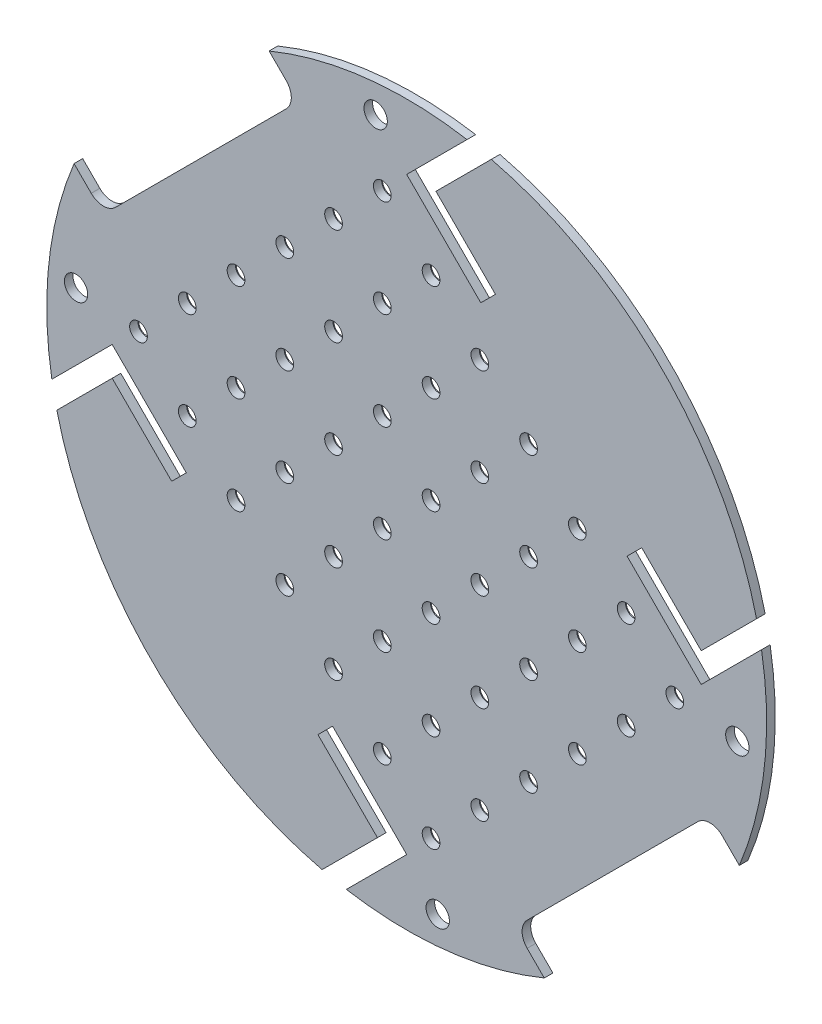
from build123d import *

# Parameters (mm, degrees)
SKETCH1_R             = 66.294
EXTRUDE1_DEPTH        = 1.5875
EXTRUDE2_DEPTH        = 94.767313219
CIRPATTERN1_COUNT     = 2
CIRPATTERN1_ANGLE     = 180
EXTRUDE3_DEPTH        = 94.767313219
CIRPATTERN4_COUNT     = 2
CIRPATTERN4_ANGLE     = 180
F_6_CLEARANCE_HOLE1_D = 4.3053
CIRPATTERN3_COUNT     = 2
CIRPATTERN3_ANGLE     = 180
LPATTERN1_COUNT       = 3
LPATTERN1_PITCH       = 12.7
LPATTERN1_COL_COUNT   = 4
LPATTERN1_COL_PITCH   = 12.7
LPATTERN2_COUNT       = 4
LPATTERN2_PITCH       = 12.7
LPATTERN2_COL_COUNT   = 4
LPATTERN2_COL_PITCH   = 12.7
FILLET1_R             = 3.175


with BuildPart() as part:
    # Sketch1 → Extrude1 (new body)
    with BuildSketch(Plane.XY):
        Circle(SKETCH1_R)
    extrude(amount=EXTRUDE1_DEPTH)

    # Sketch3 → Extrude2 (cut, through all)
    with BuildSketch(Plane.XY.offset(1.5875)):
        Polygon((12.180253029, 66.421), (66.421, 66.421), (66.421, 12.180253029), (54.240746971, 0), (40.590757667, 13.649989304), (43.284834504, 16.34406614), (54.240746971, 5.388153673), (65.507128801, 16.654535502), (65.507128801, 65.507128801), (16.654535502, 65.507128801), (5.388153673, 54.240746971), (16.34406614, 43.284834504), (13.649989304, 40.590757667), (0, 54.240746971), align=None)
    extrude2 = extrude(amount=-EXTRUDE2_DEPTH, mode=Mode.SUBTRACT)

    # CirPattern1: Extrude2 ×2 about axis
    cirpattern1_axis = Axis((0, 0, 0), (0, 0, 1))
    for i in range(1, CIRPATTERN1_COUNT):
        add(extrude2.rotate(cirpattern1_axis, i * CIRPATTERN1_ANGLE / (CIRPATTERN1_COUNT - 1)), mode=Mode.SUBTRACT)

    # Sketch11 → Extrude3 (cut, through all)
    with BuildSketch(Plane(origin=(0, 0, 0), x_dir=(-1, 0, 0), z_dir=(0, 0, -1))):
        Polygon((-55.860393937, -19.939369453), (-69.011215099, -33.090190614), (-33.090190614, -69.011215099), (-19.939369453, -55.860393937), align=None)
    extrude3 = extrude(amount=-EXTRUDE3_DEPTH, mode=Mode.SUBTRACT)

    # CirPattern4: Extrude3 ×2 about axis
    cirpattern4_axis = Axis((0, 0, 0), (0, 0, 1))
    for i in range(1, CIRPATTERN4_COUNT):
        add(extrude3.rotate(cirpattern4_axis, i * CIRPATTERN4_ANGLE / (CIRPATTERN4_COUNT - 1)), mode=Mode.SUBTRACT)

    # #6 Clearance Hole1 (through all)
    with Locations(Plane(origin=(-5.715, 60.8965, 1.5875), x_dir=(1, 0, 0), z_dir=(0, 0, 1))):
        with Locations((0, 0), (66.6115, -66.6115)):
            f_6_clearance_hole1 = Hole(F_6_CLEARANCE_HOLE1_D / 2)

    # CirPattern3: #6 Clearance Hole1 ×2 about axis
    cirpattern3_axis = Axis((0, 0, 0), (0, 0, 1))
    for i in range(1, CIRPATTERN3_COUNT):
        add(f_6_clearance_hole1.rotate(cirpattern3_axis, i * CIRPATTERN3_ANGLE / (CIRPATTERN3_COUNT - 1)), mode=Mode.SUBTRACT)

    # Sketch21 → #4 Clearance Hole1 (revolve, cut)
    with BuildSketch(Plane(origin=(-4.490128061, -4.490128061, 1.5875), x_dir=(0, -1, 0), z_dir=(1, 0, 0))):
        Polygon((0, 0), (0, 2.504574487), (1.63195, 1.524), (1.63195, 0), align=None)
    f_4_clearance_hole1 = revolve(axis=Axis((-4.490128061, -4.490128061, 7.9375), (0, 0, -1)), mode=Mode.SUBTRACT)

    # LPattern1: #4 Clearance Hole1 ×3
    with Locations(*[Vector(-0.7071067811865526, -0.7071067811865426, 0) * (i * LPATTERN1_PITCH) for i in range(1, LPATTERN1_COUNT)]):
        add(f_4_clearance_hole1, mode=Mode.SUBTRACT)

    # LPattern1 col: #4 Clearance Hole1 ×4
    with Locations(*[Vector(0.7071067811865476, 0.7071067811865475, 0) * (i * LPATTERN1_COL_PITCH) for i in range(1, LPATTERN1_COL_COUNT)]):
        add(f_4_clearance_hole1, mode=Mode.SUBTRACT)

    # LPattern2: #4 Clearance Hole1 ×4
    with Locations(*[Vector(0.7071067811865476, -0.7071067811865475, 0) * (i * LPATTERN2_PITCH) for i in range(1, LPATTERN2_COUNT)]):
        add(f_4_clearance_hole1, mode=Mode.SUBTRACT)

    # LPattern2 copy 1 sketch → LPattern2 copy 1 (revolve, cut)
    with BuildSketch(Plane(origin=(-4.490128061, -22.450640303, 1.5875), x_dir=(0, -1, 0), z_dir=(1, 0, 0))):
        Polygon((0, 0), (0, 2.504574487), (1.63195, 1.524), (1.63195, 0), align=None)
    revolve(axis=Axis((-4.490128061, -22.450640303, 7.9375), (0, 0, -1)), mode=Mode.SUBTRACT)

    # LPattern2 copy 2 sketch → LPattern2 copy 2 (revolve, cut)
    with BuildSketch(Plane(origin=(4.490128061, -31.430896424, 1.5875), x_dir=(0, -1, 0), z_dir=(1, 0, 0))):
        Polygon((0, 0), (0, 2.504574487), (1.63195, 1.524), (1.63195, 0), align=None)
    revolve(axis=Axis((4.490128061, -31.430896424, 7.9375), (0, 0, -1)), mode=Mode.SUBTRACT)

    # LPattern2 copy 3 sketch → LPattern2 copy 3 (revolve, cut)
    with BuildSketch(Plane(origin=(13.470384182, -40.411152545, 1.5875), x_dir=(0, -1, 0), z_dir=(1, 0, 0))):
        Polygon((0, 0), (0, 2.504574487), (1.63195, 1.524), (1.63195, 0), align=None)
    revolve(axis=Axis((13.470384182, -40.411152545, 7.9375), (0, 0, -1)), mode=Mode.SUBTRACT)

    # LPattern2 copy 4 sketch → LPattern2 copy 4 (revolve, cut)
    with BuildSketch(Plane(origin=(-13.470384182, -31.430896424, 1.5875), x_dir=(0, -1, 0), z_dir=(1, 0, 0))):
        Polygon((0, 0), (0, 2.504574487), (1.63195, 1.524), (1.63195, 0), align=None)
    revolve(axis=Axis((-13.470384182, -31.430896424, 7.9375), (0, 0, -1)), mode=Mode.SUBTRACT)

    # LPattern2 copy 5 sketch → LPattern2 copy 5 (revolve, cut)
    with BuildSketch(Plane(origin=(-4.490128061, -40.411152545, 1.5875), x_dir=(0, -1, 0), z_dir=(1, 0, 0))):
        Polygon((0, 0), (0, 2.504574487), (1.63195, 1.524), (1.63195, 0), align=None)
    revolve(axis=Axis((-4.490128061, -40.411152545, 7.9375), (0, 0, -1)), mode=Mode.SUBTRACT)

    # LPattern2 copy 6 sketch → LPattern2 copy 6 (revolve, cut)
    with BuildSketch(Plane(origin=(4.490128061, -49.391408666, 1.5875), x_dir=(0, -1, 0), z_dir=(1, 0, 0))):
        Polygon((0, 0), (0, 2.504574487), (1.63195, 1.524), (1.63195, 0), align=None)
    revolve(axis=Axis((4.490128061, -49.391408666, 7.9375), (0, 0, -1)), mode=Mode.SUBTRACT)

    # LPattern2 copy 7 sketch → LPattern2 copy 7 (revolve, cut)
    with BuildSketch(Plane(origin=(13.470384182, -4.490128061, 1.5875), x_dir=(0, -1, 0), z_dir=(1, 0, 0))):
        Polygon((0, 0), (0, 2.504574487), (1.63195, 1.524), (1.63195, 0), align=None)
    revolve(axis=Axis((13.470384182, -4.490128061, 7.9375), (0, 0, -1)), mode=Mode.SUBTRACT)

    # LPattern2 copy 8 sketch → LPattern2 copy 8 (revolve, cut)
    with BuildSketch(Plane(origin=(22.450640303, -13.470384182, 1.5875), x_dir=(0, -1, 0), z_dir=(1, 0, 0))):
        Polygon((0, 0), (0, 2.504574487), (1.63195, 1.524), (1.63195, 0), align=None)
    revolve(axis=Axis((22.450640303, -13.470384182, 7.9375), (0, 0, -1)), mode=Mode.SUBTRACT)

    # LPattern2 copy 9 sketch → LPattern2 copy 9 (revolve, cut)
    with BuildSketch(Plane(origin=(31.430896424, -22.450640303, 1.5875), x_dir=(0, -1, 0), z_dir=(1, 0, 0))):
        Polygon((0, 0), (0, 2.504574487), (1.63195, 1.524), (1.63195, 0), align=None)
    revolve(axis=Axis((31.430896424, -22.450640303, 7.9375), (0, 0, -1)), mode=Mode.SUBTRACT)

    # LPattern2 copy 10 sketch → LPattern2 copy 10 (revolve, cut)
    with BuildSketch(Plane(origin=(22.450640303, 4.490128061, 1.5875), x_dir=(0, -1, 0), z_dir=(1, 0, 0))):
        Polygon((0, 0), (0, 2.504574487), (1.63195, 1.524), (1.63195, 0), align=None)
    revolve(axis=Axis((22.450640303, 4.490128061, 7.9375), (0, 0, -1)), mode=Mode.SUBTRACT)

    # LPattern2 copy 11 sketch → LPattern2 copy 11 (revolve, cut)
    with BuildSketch(Plane(origin=(31.430896424, -4.490128061, 1.5875), x_dir=(0, -1, 0), z_dir=(1, 0, 0))):
        Polygon((0, 0), (0, 2.504574487), (1.63195, 1.524), (1.63195, 0), align=None)
    revolve(axis=Axis((31.430896424, -4.490128061, 7.9375), (0, 0, -1)), mode=Mode.SUBTRACT)

    # LPattern2 copy 12 sketch → LPattern2 copy 12 (revolve, cut)
    with BuildSketch(Plane(origin=(40.411152545, -13.470384182, 1.5875), x_dir=(0, -1, 0), z_dir=(1, 0, 0))):
        Polygon((0, 0), (0, 2.504574487), (1.63195, 1.524), (1.63195, 0), align=None)
    revolve(axis=Axis((40.411152545, -13.470384182, 7.9375), (0, 0, -1)), mode=Mode.SUBTRACT)

    # LPattern2 copy 13 sketch → LPattern2 copy 13 (revolve, cut)
    with BuildSketch(Plane(origin=(31.430896424, 13.470384182, 1.5875), x_dir=(0, -1, 0), z_dir=(1, 0, 0))):
        Polygon((0, 0), (0, 2.504574487), (1.63195, 1.524), (1.63195, 0), align=None)
    revolve(axis=Axis((31.430896424, 13.470384182, 7.9375), (0, 0, -1)), mode=Mode.SUBTRACT)

    # LPattern2 copy 14 sketch → LPattern2 copy 14 (revolve, cut)
    with BuildSketch(Plane(origin=(40.411152545, 4.490128061, 1.5875), x_dir=(0, -1, 0), z_dir=(1, 0, 0))):
        Polygon((0, 0), (0, 2.504574487), (1.63195, 1.524), (1.63195, 0), align=None)
    revolve(axis=Axis((40.411152545, 4.490128061, 7.9375), (0, 0, -1)), mode=Mode.SUBTRACT)

    # LPattern2 copy 15 sketch → LPattern2 copy 15 (revolve, cut)
    with BuildSketch(Plane(origin=(49.391408666, -4.490128061, 1.5875), x_dir=(0, -1, 0), z_dir=(1, 0, 0))):
        Polygon((0, 0), (0, 2.504574487), (1.63195, 1.524), (1.63195, 0), align=None)
    revolve(axis=Axis((49.391408666, -4.490128061, 7.9375), (0, 0, -1)), mode=Mode.SUBTRACT)

    # LPattern2 col: #4 Clearance Hole1 ×4
    with Locations(*[Vector(-0.7071067811865526, 0.7071067811865426, 0) * (i * LPATTERN2_COL_PITCH) for i in range(1, LPATTERN2_COL_COUNT)]):
        add(f_4_clearance_hole1, mode=Mode.SUBTRACT)

    # LPattern2 col copy 1 sketch → LPattern2 col copy 1 (revolve, cut)
    with BuildSketch(Plane(origin=(-22.450640303, -4.490128061, 1.5875), x_dir=(0, -1, 0), z_dir=(1, 0, 0))):
        Polygon((0, 0), (0, 2.504574487), (1.63195, 1.524), (1.63195, 0), align=None)
    revolve(axis=Axis((-22.450640303, -4.490128061, 7.9375), (0, 0, -1)), mode=Mode.SUBTRACT)

    # LPattern2 col copy 2 sketch → LPattern2 col copy 2 (revolve, cut)
    with BuildSketch(Plane(origin=(-31.430896424, 4.490128061, 1.5875), x_dir=(0, -1, 0), z_dir=(1, 0, 0))):
        Polygon((0, 0), (0, 2.504574487), (1.63195, 1.524), (1.63195, 0), align=None)
    revolve(axis=Axis((-31.430896424, 4.490128061, 7.9375), (0, 0, -1)), mode=Mode.SUBTRACT)

    # LPattern2 col copy 3 sketch → LPattern2 col copy 3 (revolve, cut)
    with BuildSketch(Plane(origin=(-40.411152545, 13.470384182, 1.5875), x_dir=(0, -1, 0), z_dir=(1, 0, 0))):
        Polygon((0, 0), (0, 2.504574487), (1.63195, 1.524), (1.63195, 0), align=None)
    revolve(axis=Axis((-40.411152545, 13.470384182, 7.9375), (0, 0, -1)), mode=Mode.SUBTRACT)

    # LPattern2 col copy 4 sketch → LPattern2 col copy 4 (revolve, cut)
    with BuildSketch(Plane(origin=(-31.430896424, -13.470384182, 1.5875), x_dir=(0, -1, 0), z_dir=(1, 0, 0))):
        Polygon((0, 0), (0, 2.504574487), (1.63195, 1.524), (1.63195, 0), align=None)
    revolve(axis=Axis((-31.430896424, -13.470384182, 7.9375), (0, 0, -1)), mode=Mode.SUBTRACT)

    # LPattern2 col copy 5 sketch → LPattern2 col copy 5 (revolve, cut)
    with BuildSketch(Plane(origin=(-40.411152545, -4.490128061, 1.5875), x_dir=(0, -1, 0), z_dir=(1, 0, 0))):
        Polygon((0, 0), (0, 2.504574487), (1.63195, 1.524), (1.63195, 0), align=None)
    revolve(axis=Axis((-40.411152545, -4.490128061, 7.9375), (0, 0, -1)), mode=Mode.SUBTRACT)

    # LPattern2 col copy 6 sketch → LPattern2 col copy 6 (revolve, cut)
    with BuildSketch(Plane(origin=(-49.391408666, 4.490128061, 1.5875), x_dir=(0, -1, 0), z_dir=(1, 0, 0))):
        Polygon((0, 0), (0, 2.504574487), (1.63195, 1.524), (1.63195, 0), align=None)
    revolve(axis=Axis((-49.391408666, 4.490128061, 7.9375), (0, 0, -1)), mode=Mode.SUBTRACT)

    # LPattern2 col copy 7 sketch → LPattern2 col copy 7 (revolve, cut)
    with BuildSketch(Plane(origin=(-4.490128061, 13.470384182, 1.5875), x_dir=(0, -1, 0), z_dir=(1, 0, 0))):
        Polygon((0, 0), (0, 2.504574487), (1.63195, 1.524), (1.63195, 0), align=None)
    revolve(axis=Axis((-4.490128061, 13.470384182, 7.9375), (0, 0, -1)), mode=Mode.SUBTRACT)

    # LPattern2 col copy 8 sketch → LPattern2 col copy 8 (revolve, cut)
    with BuildSketch(Plane(origin=(-13.470384182, 22.450640303, 1.5875), x_dir=(0, -1, 0), z_dir=(1, 0, 0))):
        Polygon((0, 0), (0, 2.504574487), (1.63195, 1.524), (1.63195, 0), align=None)
    revolve(axis=Axis((-13.470384182, 22.450640303, 7.9375), (0, 0, -1)), mode=Mode.SUBTRACT)

    # LPattern2 col copy 9 sketch → LPattern2 col copy 9 (revolve, cut)
    with BuildSketch(Plane(origin=(-22.450640303, 31.430896424, 1.5875), x_dir=(0, -1, 0), z_dir=(1, 0, 0))):
        Polygon((0, 0), (0, 2.504574487), (1.63195, 1.524), (1.63195, 0), align=None)
    revolve(axis=Axis((-22.450640303, 31.430896424, 7.9375), (0, 0, -1)), mode=Mode.SUBTRACT)

    # LPattern2 col copy 10 sketch → LPattern2 col copy 10 (revolve, cut)
    with BuildSketch(Plane(origin=(4.490128061, 22.450640303, 1.5875), x_dir=(0, -1, 0), z_dir=(1, 0, 0))):
        Polygon((0, 0), (0, 2.504574487), (1.63195, 1.524), (1.63195, 0), align=None)
    revolve(axis=Axis((4.490128061, 22.450640303, 7.9375), (0, 0, -1)), mode=Mode.SUBTRACT)

    # LPattern2 col copy 11 sketch → LPattern2 col copy 11 (revolve, cut)
    with BuildSketch(Plane(origin=(-4.490128061, 31.430896424, 1.5875), x_dir=(0, -1, 0), z_dir=(1, 0, 0))):
        Polygon((0, 0), (0, 2.504574487), (1.63195, 1.524), (1.63195, 0), align=None)
    revolve(axis=Axis((-4.490128061, 31.430896424, 7.9375), (0, 0, -1)), mode=Mode.SUBTRACT)

    # LPattern2 col copy 12 sketch → LPattern2 col copy 12 (revolve, cut)
    with BuildSketch(Plane(origin=(-13.470384182, 40.411152545, 1.5875), x_dir=(0, -1, 0), z_dir=(1, 0, 0))):
        Polygon((0, 0), (0, 2.504574487), (1.63195, 1.524), (1.63195, 0), align=None)
    revolve(axis=Axis((-13.470384182, 40.411152545, 7.9375), (0, 0, -1)), mode=Mode.SUBTRACT)

    # LPattern2 col copy 13 sketch → LPattern2 col copy 13 (revolve, cut)
    with BuildSketch(Plane(origin=(13.470384182, 31.430896424, 1.5875), x_dir=(0, -1, 0), z_dir=(1, 0, 0))):
        Polygon((0, 0), (0, 2.504574487), (1.63195, 1.524), (1.63195, 0), align=None)
    revolve(axis=Axis((13.470384182, 31.430896424, 7.9375), (0, 0, -1)), mode=Mode.SUBTRACT)

    # LPattern2 col copy 14 sketch → LPattern2 col copy 14 (revolve, cut)
    with BuildSketch(Plane(origin=(4.490128061, 40.411152545, 1.5875), x_dir=(0, -1, 0), z_dir=(1, 0, 0))):
        Polygon((0, 0), (0, 2.504574487), (1.63195, 1.524), (1.63195, 0), align=None)
    revolve(axis=Axis((4.490128061, 40.411152545, 7.9375), (0, 0, -1)), mode=Mode.SUBTRACT)

    # LPattern2 col copy 15 sketch → LPattern2 col copy 15 (revolve, cut)
    with BuildSketch(Plane(origin=(-4.490128061, 49.391408666, 1.5875), x_dir=(0, -1, 0), z_dir=(1, 0, 0))):
        Polygon((0, 0), (0, 2.504574487), (1.63195, 1.524), (1.63195, 0), align=None)
    revolve(axis=Axis((-4.490128061, 49.391408666, 7.9375), (0, 0, -1)), mode=Mode.SUBTRACT)

    # Fillet1
    fillet1_edges = [part.edges().sort_by_distance(p)[0] for p in [
        (19.939369453, -55.860393937, 0.79375),
        (55.860393937, -19.939369453, 0.79375),
        (-19.939369453, 55.860393937, 0.79375),
        (-55.860393937, 19.939369453, 0.79375),
    ]]
    fillet(fillet1_edges, radius=FILLET1_R)


solid = part.part
